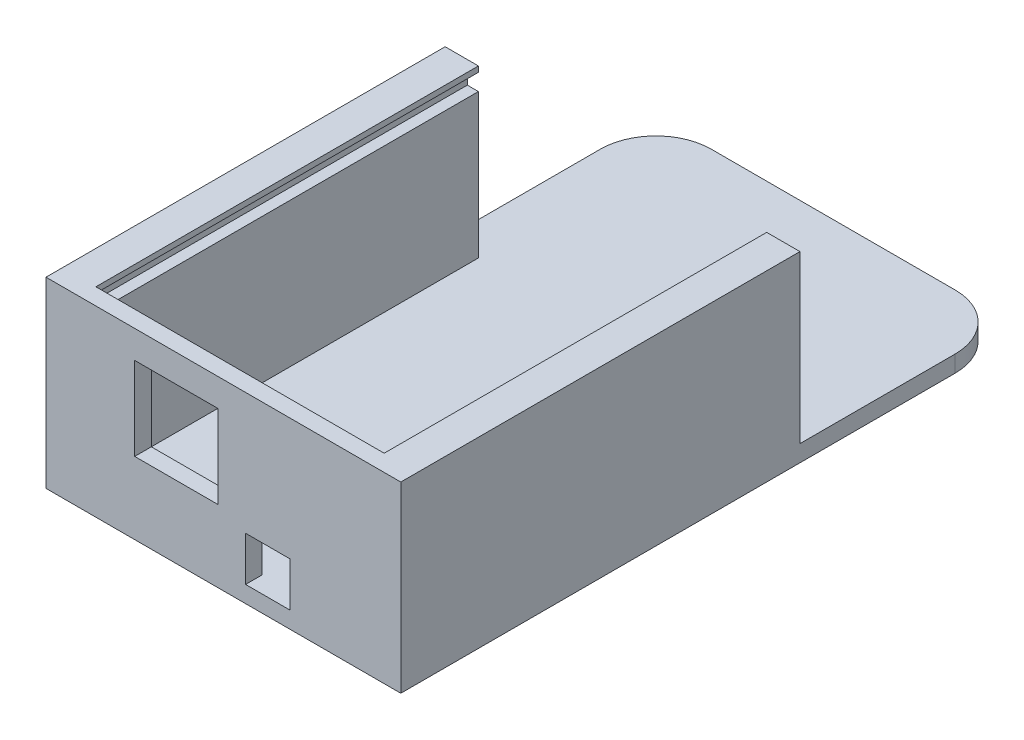
from build123d import *

# Parameters (mm, degrees)
SKETCH1_W            = 32
SKETCH1_H            = 110
BOSS_EXTRUDE1_DEPTH  = 3
SKETCH2_W            = 6
SKETCH2_H            = 69
BOSS_EXTRUDE2_DEPTH  = 30
CUT_EXTRUDE1_DEPTH   = 69
FILLET1_R            = 10
FILLET1_OF_MIRROR1_R = 10
SKETCH4_W            = 15
SKETCH4_H            = 15
SKETCH4_W_2          = 8
SKETCH4_H_2          = 8
CUT_EXTRUDE2_DEPTH   = 117.456000275


with BuildPart() as part:
    # Sketch1 → Boss-Extrude1 (new body)
    with BuildSketch(Plane(origin=(0, 0, 0), x_dir=(1, 0, 0), z_dir=(0, 1, 0))):
        with Locations((16, 55)):
            Rectangle(SKETCH1_W, SKETCH1_H)
    boss_extrude1 = extrude(amount=BOSS_EXTRUDE1_DEPTH)

    # Sketch2 → Boss-Extrude2 (add)
    with BuildSketch(Plane(origin=(0, 3, 0), x_dir=(1, 0, 0), z_dir=(0, 1, 0))):
        Polygon((0, 3), (0, 0), (32, 0), (32, 3), (26, 3), align=None)
        with Locations((29, 37.5)):
            Rectangle(SKETCH2_W, SKETCH2_H)
    boss_extrude2 = extrude(amount=BOSS_EXTRUDE2_DEPTH)

    # Sketch3 → Cut-Extrude1 (cut)
    with BuildSketch(Plane(origin=(0, 0, -72), x_dir=(-1, 0, 0), z_dir=(0, 0, -1))):
        Polygon((-26, 32), (-28, 30), (-28, 29), (-26, 29), align=None)
    cut_extrude1 = extrude(amount=-CUT_EXTRUDE1_DEPTH, mode=Mode.SUBTRACT)

    # Fillet1
    fillet1_edges = [part.edges().sort_by_distance(p)[0] for p in [
        (32, 1.5, -110),
    ]]
    fillet(fillet1_edges, radius=FILLET1_R)

    # Mirror1: Boss-Extrude1, Boss-Extrude2, Cut-Extrude1 across plane
    add(boss_extrude1.mirror(Plane(origin=(0, 3, 0), x_dir=(0, 0, 1), z_dir=(1, 0, 0))))
    add(boss_extrude2.mirror(Plane(origin=(0, 3, 0), x_dir=(0, 0, 1), z_dir=(1, 0, 0))))
    add(cut_extrude1.mirror(Plane(origin=(0, 3, 0), x_dir=(0, 0, 1), z_dir=(1, 0, 0))), mode=Mode.SUBTRACT)

    # Fillet1 of Mirror1
    fillet1_of_mirror1_edges = [part.edges().sort_by_distance(p)[0] for p in [
        (-32, 1.5, -110),
    ]]
    fillet(fillet1_of_mirror1_edges, radius=FILLET1_OF_MIRROR1_R)

    # Sketch4 → Cut-Extrude2 (cut, through all)
    with BuildSketch(Plane(origin=(0, 0, -3), x_dir=(-1, 0, 0), z_dir=(0, 0, -1))):
        with Locations((8.5, 20.5)):
            Rectangle(SKETCH4_W, SKETCH4_H)
        with Locations((-8, 7)):
            Rectangle(SKETCH4_W_2, SKETCH4_H_2)
    extrude(amount=-CUT_EXTRUDE2_DEPTH, mode=Mode.SUBTRACT)


solid = part.part
